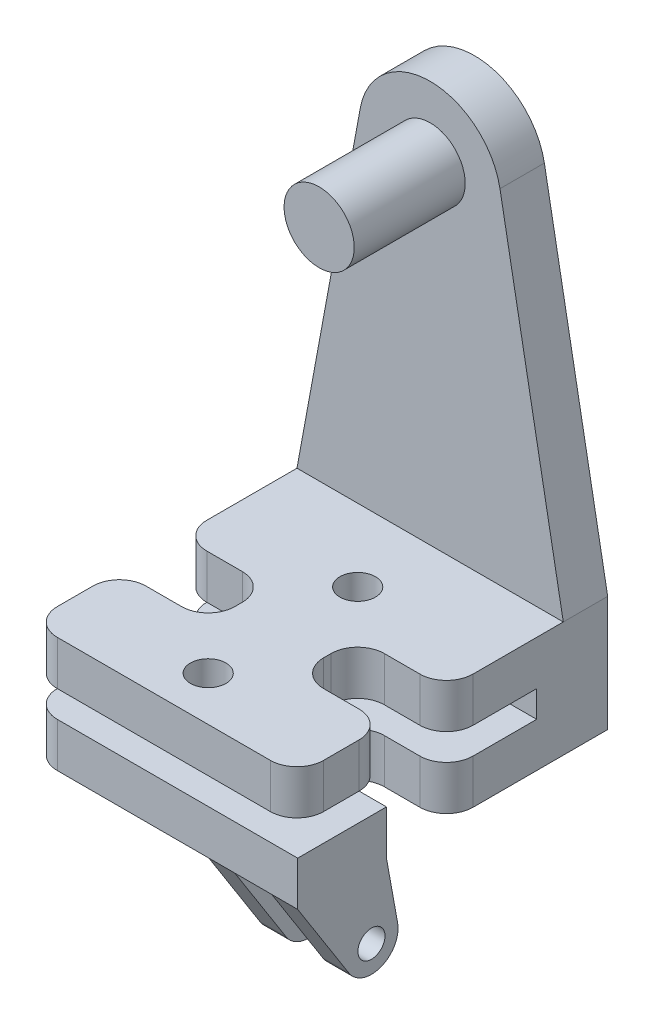
from build123d import *

# Parameters (mm, degrees)
SKETCH_1_R          = 3.95
SKETCH_1_W          = 30
SKETCH_1_H          = 5
SKETCH_1_H_2        = 3
EXTRUDE_1_DEPTH     = 5
SKETCH_1_3_W        = 30
SKETCH_1_3_H        = 5
EXTRUDE_2_DEPTH     = 35
SKETCH_1_5_R        = 3.95
EXTRUDE_3_DEPTH     = 17.5
SKETCH_1_6_W        = 30
SKETCH_1_6_H        = 3
EXTRUDE_4_DEPTH     = 8
SKETCH_2_W          = 10
SKETCH_2_H          = 6.84
SKETCH_2_R          = 2
CUT_EXTRUDE_1_DEPTH = 16
SKETCH_2_3_W        = 10
SKETCH_2_3_H        = 10
EXTRUDE_5_DEPTH     = 13
SKETCH_2_4_W        = 10
SKETCH_2_4_H        = 10
CUT_EXTRUDE_2_DEPTH = 8
FILLET_1_R          = 3
SKETCH_3_W          = 9.92
SKETCH_3_H          = 10
CUT_EXTRUDE_4_DEPTH = 8
SKETCH_4_R          = 1.525
EXTRUDE_6_DEPTH     = 2.92


with BuildPart() as part:
    # 草图1 → 凸台-拉伸1 (new body)
    # profile 1 of 4: a face of its own
    with BuildSketch(Plane.XY):
        with BuildLine():
            ThreePointArc((-7.867496672, 46.69999866), (0, 53.25), (7.867496672, 46.69999866))
            Line((7.867496672, 46.69999866), (15, 8))
            Line((15, 8), (-15, 8))
            Line((-15, 8), (-7.867496672, 46.69999866))
        make_face()
        with Locations((0, 45.25)):
            Circle(SKETCH_1_R, mode=Mode.SUBTRACT)
    # profile 2 of 4: a face of its own
    with BuildSketch(Plane.XY):
        with Locations((0, -2.5)):
            Rectangle(SKETCH_1_W, SKETCH_1_H)
    # profile 3 of 4: a face of its own
    with BuildSketch(Plane.XY):
        with Locations((0, 5.5)):
            Rectangle(SKETCH_1_W, SKETCH_1_H)
    # profile 4 of 4: a face of its own
    with BuildSketch(Plane.XY):
        with Locations((0, 1.5)):
            Rectangle(SKETCH_1_W, SKETCH_1_H_2)
    extrude(amount=EXTRUDE_1_DEPTH)

    # 草图1<3> → 凸台-拉伸2 (add)
    with BuildSketch(Plane.XY):
        with Locations((0, 5.5)):
            Rectangle(SKETCH_1_3_W, SKETCH_1_3_H)
        with Locations((0, -2.5)):
            Rectangle(SKETCH_1_3_W, SKETCH_1_3_H)
    extrude(amount=EXTRUDE_2_DEPTH)

    # 草图1<5> → 凸台-拉伸3 (add)
    with BuildSketch(Plane.XY):
        with Locations((0, 45.25)):
            Circle(SKETCH_1_5_R)
    extrude(amount=EXTRUDE_3_DEPTH)

    # 草图1<6> → 凸台-拉伸4 (add)
    with BuildSketch(Plane.XY):
        with Locations((0, 1.5)):
            Rectangle(SKETCH_1_6_W, SKETCH_1_6_H)
    extrude(amount=EXTRUDE_4_DEPTH)

    # 草图2 → 切除-拉伸1 (cut)
    with BuildSketch(Plane(origin=(0, 8, 0), x_dir=(1, 0, 0), z_dir=(0, 1, 0))):
        with Locations((-10, -21.58)):
            Rectangle(SKETCH_2_W, SKETCH_2_H)
        with Locations((10, -21.58)):
            Rectangle(SKETCH_2_W, SKETCH_2_H)
        with Locations(Location((0, -13.16, 0), (0, 0, 270))):
            Circle(SKETCH_2_R)
        with Locations(Location((0, -30, 0), (0, 0, 270))):
            Circle(SKETCH_2_R)
    extrude(amount=-CUT_EXTRUDE_1_DEPTH, mode=Mode.SUBTRACT)

    # 草图2<3> → 凸台-拉伸5 (add)
    with BuildSketch(Plane(origin=(0, 8, 0), x_dir=(1, 0, 0), z_dir=(0, 1, 0))):
        with Locations((20, -30)):
            Rectangle(SKETCH_2_3_W, SKETCH_2_3_H)
    extrude(amount=-EXTRUDE_5_DEPTH)

    # 草图2<4> → 切除-拉伸2 (cut)
    with BuildSketch(Plane(origin=(0, 8, 0), x_dir=(1, 0, 0), z_dir=(0, 1, 0))):
        with Locations((20, -30)):
            Rectangle(SKETCH_2_4_W, SKETCH_2_4_H)
    extrude(amount=-CUT_EXTRUDE_2_DEPTH, mode=Mode.SUBTRACT)

    # 圆角1
    fillet_1_edges = [part.edges().sort_by_distance(p)[0] for p in [
        (-15, -2.5, 18.16),
        (-15, 5.5, 18.16),
        (-5, -2.5, 18.16),
        (-5, 5.5, 18.16),
        (-5, -2.5, 25),
        (-5, 5.5, 25),
        (-15, -2.5, 25),
        (-15, 5.5, 25),
        (5, -2.5, 25),
        (5, 5.5, 25),
        (5, -2.5, 18.16),
        (5, 5.5, 18.16),
        (15, -2.5, 18.16),
        (15, 5.5, 18.16),
        (15, 5.5, 35),
        (15, 5.5, 25),
        (-15, 5.5, 35),
        (-15, -2.5, 35),
    ]]
    fillet(fillet_1_edges, radius=FILLET_1_R)

    # 草图3 → 切除-拉伸4 (cut)
    with BuildSketch(Plane.XZ.offset(5)):
        with Locations((20.04, 30)):
            Rectangle(SKETCH_3_W, SKETCH_3_H)
    extrude(amount=-CUT_EXTRUDE_4_DEPTH, mode=Mode.SUBTRACT)

    # 草图4 → 凸台-拉伸6 (add)
    with BuildSketch(Plane(origin=(15.08, 0, 0), x_dir=(0, 0, -1), z_dir=(1, 0, 0))):
        with BuildLine():
            Line((-35, -5), (-29.223331883, -14.106931726))
            ThreePointArc((-29.223331883, -14.106931726), (-25.598856813, -15.294531543), (-23.738058654, -11.965170783))
            Line((-23.738058654, -11.965170783), (-25, -5))
            Line((-25, -5), (-35, -5))
        make_face()
        with Locations((-26.69, -12.5)):
            Circle(SKETCH_4_R, mode=Mode.SUBTRACT)
    extrude_6 = extrude(amount=-EXTRUDE_6_DEPTH)

    # 镜向1: 凸台-拉伸6 across plane
    add(extrude_6.mirror(Plane(origin=(10.08, 0, 0), x_dir=(0, 0, 1), z_dir=(1, 0, 0))))


solid = part.part
